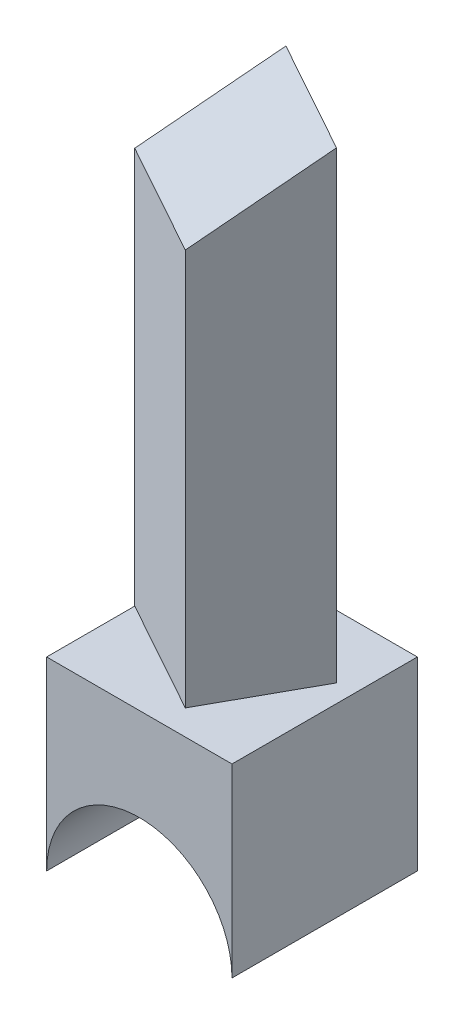
from build123d import *

# Parameters (mm, degrees)
BOSS_EXTRUDE1_DEPTH = 100
BOSS_EXTRUDE2_DEPTH = 250
CUT_EXTRUDE1_DEPTH  = 70


with BuildPart() as part:
    # Sketch2 → Boss-Extrude1 (new body)
    with BuildSketch(Plane.XY):
        with BuildLine():
            Line((-50, 50), (50, 50))
            Line((50, 50), (50, -50))
            ThreePointArc((50, -50), (0, 0), (-50, -50))
            Line((-50, -50), (-50, 50))
        make_face()
    extrude(amount=BOSS_EXTRUDE1_DEPTH)

    # Sketch4 → Boss-Extrude2 (add)
    with BuildSketch(Plane(origin=(0, 50, 0), x_dir=(1, 0, 0), z_dir=(0, 1, 0))):
        Polygon((-20.911422785, 0), (40.311956715, -33.936673417), (11.2233795, -86.413855846), (-50, -52.477182428), align=None)
    extrude(amount=BOSS_EXTRUDE2_DEPTH)

    # Sketch5 → Cut-Extrude1 (cut)
    with BuildSketch(Plane(origin=(45.226985219, 0, 25.069727277), x_dir=(0.4848096202463318, 0, -0.8746197071393987), z_dir=(0.8746197071393988, 0, 0.48480962024633184))):
        Polygon((-10.138058939, 300), (-70.138058939, 263.948362858), (-70.138058939, 300), align=None)
    extrude(amount=-CUT_EXTRUDE1_DEPTH, mode=Mode.SUBTRACT)


solid = part.part
